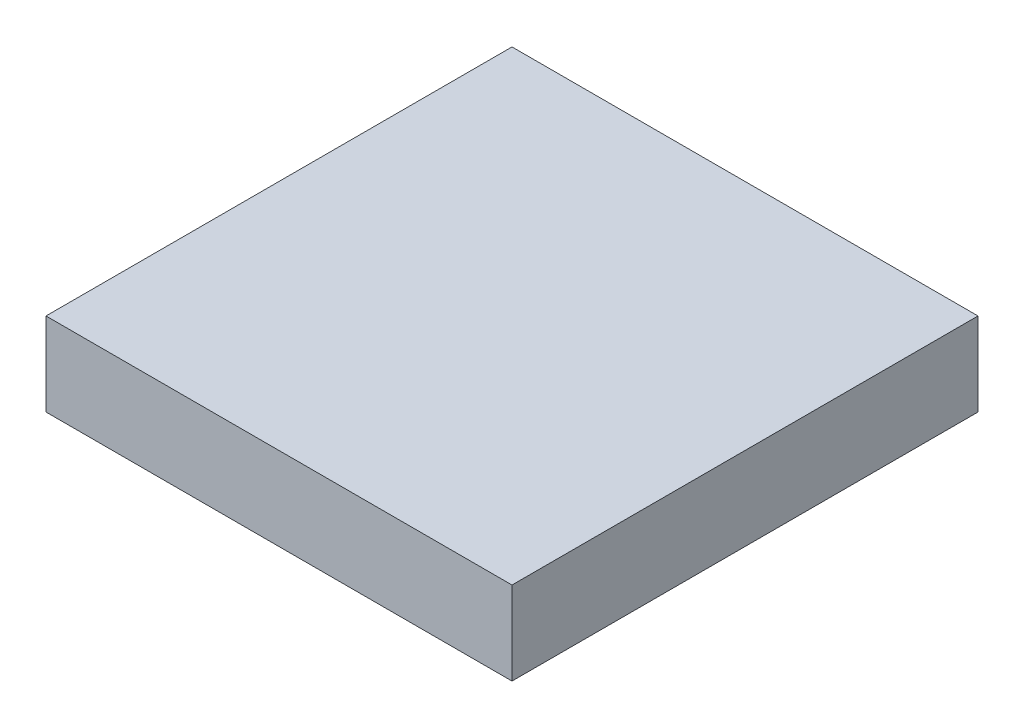
from build123d import *

# Parameters (mm, degrees)
SKETCH1_W           = 711.2
SKETCH1_H           = 711.2
BOSS_EXTRUDE1_DEPTH = 127


with BuildPart() as part:
    # Sketch1 → Boss-Extrude1 (new body)
    with BuildSketch(Plane(origin=(0, 0, 0), x_dir=(1, 0, 0), z_dir=(0, 1, 0))):
        Rectangle(SKETCH1_W, SKETCH1_H)
    extrude(amount=BOSS_EXTRUDE1_DEPTH)


solid = part.part
